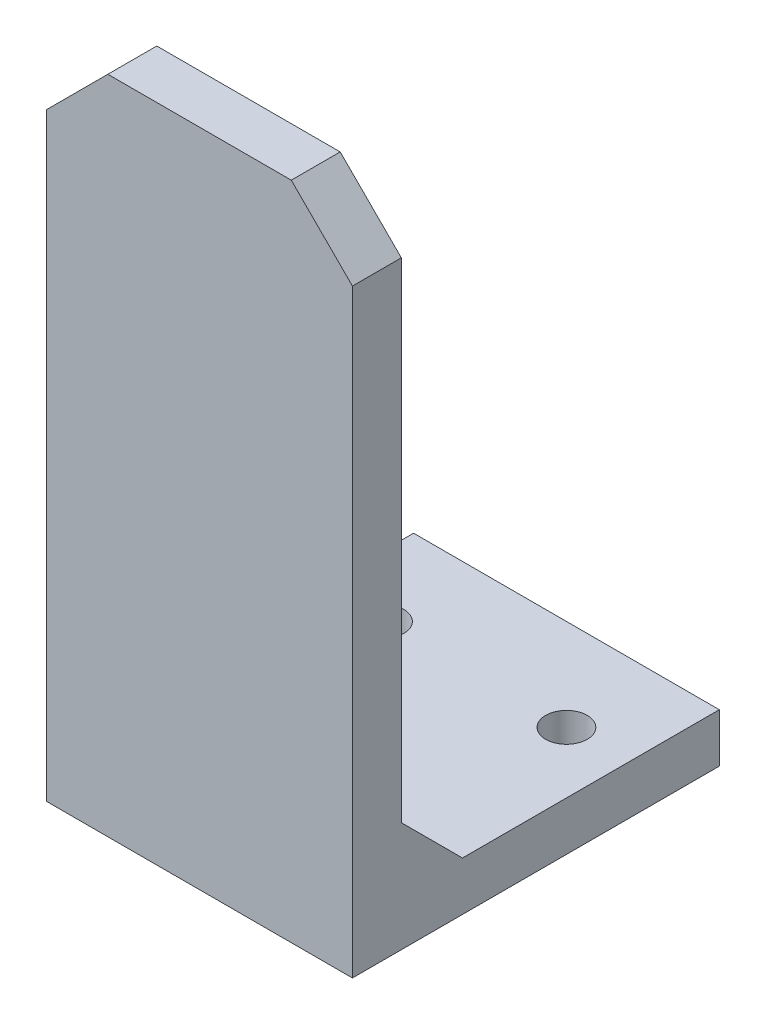
from build123d import *

# Parameters (mm, degrees)
SKETCH_1_W      = 25
SKETCH_1_H      = 30
SKETCH_1_R      = 1.7
EXTRUDE_1_DEPTH = 4
SKETCH_2_W      = 25
SKETCH_2_H      = 4
EXTRUDE_2_DEPTH = 50
EXTRUDE_3_DEPTH = 25
SKETCH_4_R      = 2.9
EXTRUDE_4_DEPTH = 5
CHAMFER_2_SIZE  = 5


with BuildPart() as part:
    # 草图1 → 凸台-拉伸1 (new body)
    with BuildSketch(Plane(origin=(0, 0, 0), x_dir=(1, 0, 0), z_dir=(0, 1, 0))):
        with Locations((12.5, 15)):
            Rectangle(SKETCH_1_W, SKETCH_1_H)
        with Locations(Location((5, 22.5, 0), (0, 0, 270))):
            Circle(SKETCH_1_R, mode=Mode.SUBTRACT)
        with Locations(Location((20, 22.5, 0), (0, 0, 270))):
            Circle(SKETCH_1_R, mode=Mode.SUBTRACT)
    extrude(amount=EXTRUDE_1_DEPTH)

    # 草图2 → 凸台-拉伸2 (add)
    with BuildSketch(Plane(origin=(0, 4, 0), x_dir=(1, 0, 0), z_dir=(0, 1, 0))):
        with Locations((12.5, 2)):
            Rectangle(SKETCH_2_W, SKETCH_2_H)
    extrude(amount=EXTRUDE_2_DEPTH)

    # 草图3 → 凸台-拉伸3 (add)
    with BuildSketch(Plane(origin=(25, 0, 0), x_dir=(0, 0, -1), z_dir=(1, 0, 0))):
        Polygon((4, 4), (4, 9), (9, 4), align=None)
    extrude(amount=-EXTRUDE_3_DEPTH)

    # 草图4 → 凸台-拉伸4 (add)
    with BuildSketch(Plane(origin=(0, 0, -4), x_dir=(-1, 0, 0), z_dir=(0, 0, -1))):
        with Locations(Location((-12.5, 39, 0), (0, 0, 180))):
            Circle(SKETCH_4_R)
    extrude(amount=EXTRUDE_4_DEPTH)

    # 倒角2
    chamfer_2_edges = [part.edges().sort_by_distance(p)[0] for p in [
        (0, 54, -2),
        (25, 54, -2),
    ]]
    chamfer(chamfer_2_edges, length=CHAMFER_2_SIZE)


solid = part.part
